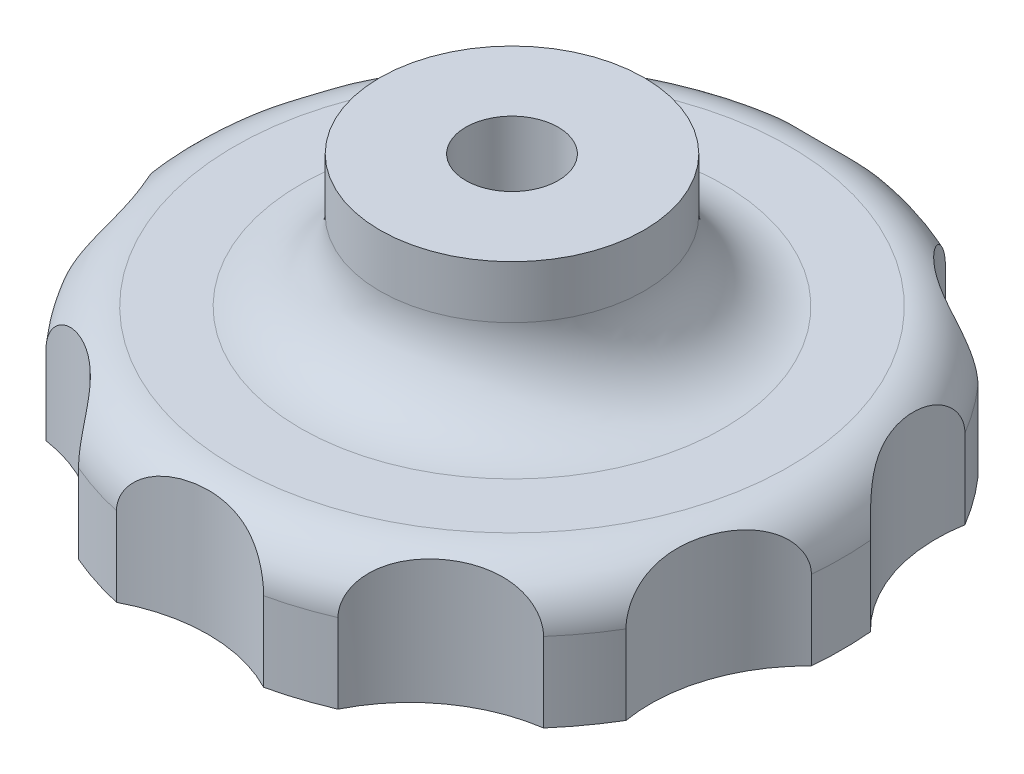
from build123d import *

# Parameters (mm, degrees)
FILETE1_R             = 3
FILETE2_R             = 2
ESBO_O2_R             = 6
CORTE_EXTRUS_O1_DEPTH = 5
PADR_OCIRCULAR1_COUNT = 10
ESBO_O3_R             = 1.75
CORTE_EXTRUS_O2_DEPTH = 10
CORTE_EXTRUS_O3_DEPTH = 2.4


with BuildPart() as part:
    # Esboço1 → Revolução1 (revolve)
    with BuildSketch(Plane.XY, mode=Mode.PRIVATE) as revolu_o1_sk:
        Polygon((0, 0), (12.5, 0), (12.5, 5), (5, 5), (5, 10), (0, 10), align=None)
    revolve(revolu_o1_sk.sketch.rotate(Axis((0, 0, 0), (0, 1, 0)), 90), axis=Axis((0, 0, 0), (0, 1, 0)))

    # Filete1
    filete1_edges = [part.edges().sort_by_distance(p)[0] for p in [
        (0, 5, 5),
    ]]
    fillet(filete1_edges, radius=FILETE1_R)

    # Filete2
    filete2_edges = [part.edges().sort_by_distance(p)[0] for p in [
        (0, 5, 12.5),
    ]]
    fillet(filete2_edges, radius=FILETE2_R)

    # Esboço2 → Corte-extrusão1 (cut)
    with BuildSketch(Plane.XZ):
        with Locations((0, 17.5)):
            Circle(ESBO_O2_R)
    corte_extrus_o1 = extrude(amount=-CORTE_EXTRUS_O1_DEPTH, mode=Mode.SUBTRACT)

    # PadrãoCircular1: Corte-extrusão1 ×10 about axis
    padr_ocircular1_axis = Axis((0, 0, 0), (0, 1, 0))
    for i in range(1, PADR_OCIRCULAR1_COUNT):
        add(corte_extrus_o1.rotate(padr_ocircular1_axis, i * 360 / PADR_OCIRCULAR1_COUNT), mode=Mode.SUBTRACT)

    # Esboço3 → Corte-extrusão2 (cut)
    with BuildSketch(Plane.XZ):
        with Locations(Location((0, 0, 0), (0, 0, 270))):
            Circle(ESBO_O3_R)
    extrude(amount=-CORTE_EXTRUS_O2_DEPTH, mode=Mode.SUBTRACT)

    # Esboço4 → Corte-extrusão3 (cut)
    with BuildSketch(Plane.XZ):
        Polygon((3.175426481, 0), (1.58771324, 2.75), (-1.58771324, 2.75), (-3.175426481, 0), (-1.58771324, -2.75), (1.58771324, -2.75), align=None)
    extrude(amount=-CORTE_EXTRUS_O3_DEPTH, mode=Mode.SUBTRACT)


solid = part.part
